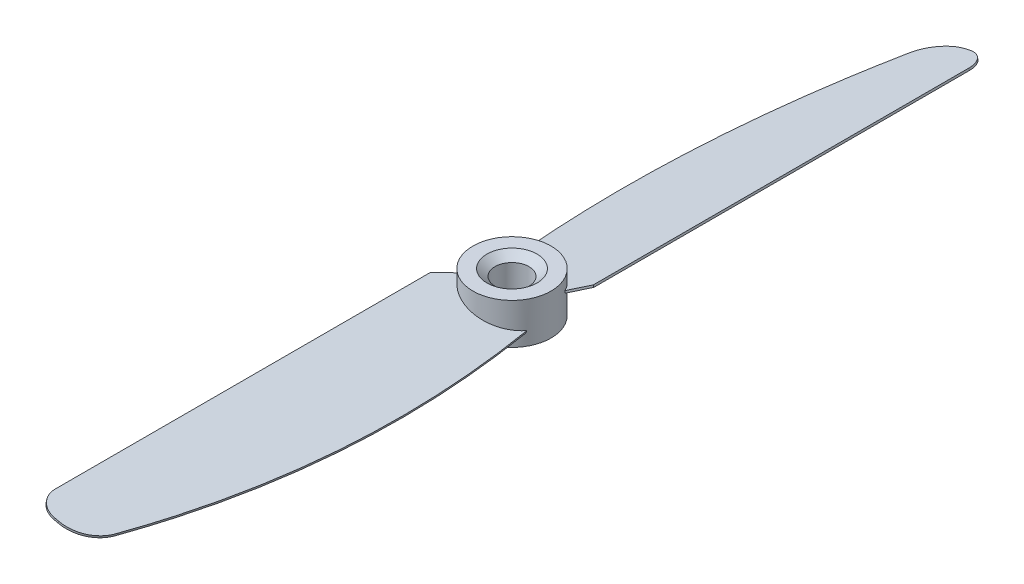
from build123d import *
from OCP.BRepFilletAPI import BRepFilletAPI_MakeChamfer

# Parameters (mm, degrees)
SKETCH1_R           = 5.75
BOSS_EXTRUDE1_DEPTH = 3
BOSS_EXTRUDE2_DEPTH = 0.15
CIRPATTERN1_COUNT   = 2
SKETCH4_R           = 2.5
CUT_EXTRUDE1_DEPTH  = 65.150588849
CHAMFER2_SIZE       = 1
CHAMFER2_SIZE2      = 1.191753593


with BuildPart() as part:
    # Sketch1 → Boss-Extrude1 (new, symmetric)
    with BuildSketch(Plane(origin=(0, 0, 0), x_dir=(1, 0, 0), z_dir=(0, 1, 0))):
        with Locations(Location((0, 0, 0), (0, 0, 270))):
            Circle(SKETCH1_R)
    extrude(amount=BOSS_EXTRUDE1_DEPTH, both=True)

    # Sketch3 → Boss-Extrude2 (add, symmetric)
    with BuildSketch(Plane(origin=(0, 0, 0), x_dir=(0.9743700647852351, -0.2249510543438655, 0), z_dir=(-0.2249510543438655, -0.9743700647852351, 0))):
        with BuildLine():
            Line((-4.594330289, 1.95406384), (-7.004950747, 5.194012526))
            Line((-7.004950747, 5.194012526), (-7.004950747, 60.5))
            ThreePointArc((-7.004950747, 60.5), (-6.12627109, 62.621320344), (-4.004950747, 63.5))
            Line((-4.004950747, 63.5), (-3.349097477, 63.5))
            ThreePointArc((-3.349097477, 63.5), (-0.196862037, 62.381161132), (1.54463599, 59.525364693))
            add(Edge.make_bspline(
                [(1.54463599, 59.525364693), (9.475219296, 30.694015203), (4.834288523, 1.046023407)],
                knots=[0, 0, 0, 1, 1, 1], degree=2))
            add(Edge.make_bspline(
                [(-4.594330289, 1.95406384), (0.469577579, 8.859977358), (4.834288523, 1.046023407)],
                knots=[0, 0, 0, 1, 1, 1], degree=2))
        make_face()
    boss_extrude2 = extrude(amount=BOSS_EXTRUDE2_DEPTH, both=True)

    # CirPattern1: Boss-Extrude2 ×2 about axis
    cirpattern1_axis = Axis((0, 3, 0), (0, -1, 0))
    for i in range(1, CIRPATTERN1_COUNT):
        add(boss_extrude2.rotate(cirpattern1_axis, i * 360 / CIRPATTERN1_COUNT))

    # Sketch4 → Cut-Extrude1 (cut, through all)
    with BuildSketch(Plane.XZ.offset(3)):
        with Locations(Location((0, 0, 0), (0, 0, 270))):
            Circle(SKETCH4_R)
    extrude(amount=-CUT_EXTRUDE1_DEPTH, mode=Mode.SUBTRACT)

    # Chamfer2: one chamfer whose edges measure the first distance from different faces: ONE call of the kernel's chamfer builder (chamfer() names one face for all edges)
    chamfer2_edges_1 = [part.edges().sort_by_distance(p)[0] for p in [
        (0, 3, 2.5),
    ]]
    chamfer2_side_1 = [part.faces().sort_by_distance(p)[0] for p in [
        (0, 0, 2.5),
    ]]
    chamfer2_edges_2 = [part.edges().sort_by_distance(p)[0] for p in [
        (0, -3, 2.5),
    ]]
    chamfer2_side_2 = [part.faces().sort_by_distance(p)[0] for p in [
        (0, -3, -5.58736544),
    ]]
    chamfer2 = BRepFilletAPI_MakeChamfer(part.part.solid().wrapped)
    for e in chamfer2_edges_1:
        chamfer2.Add(CHAMFER2_SIZE, CHAMFER2_SIZE2, e.wrapped, chamfer2_side_1[0].wrapped)  # the first distance lies on this face
    for e in chamfer2_edges_2:
        chamfer2.Add(CHAMFER2_SIZE, CHAMFER2_SIZE2, e.wrapped, chamfer2_side_2[0].wrapped)  # the first distance lies on this face
    add(Compound.cast(chamfer2.Shape()), mode=Mode.REPLACE)


solid = part.part
